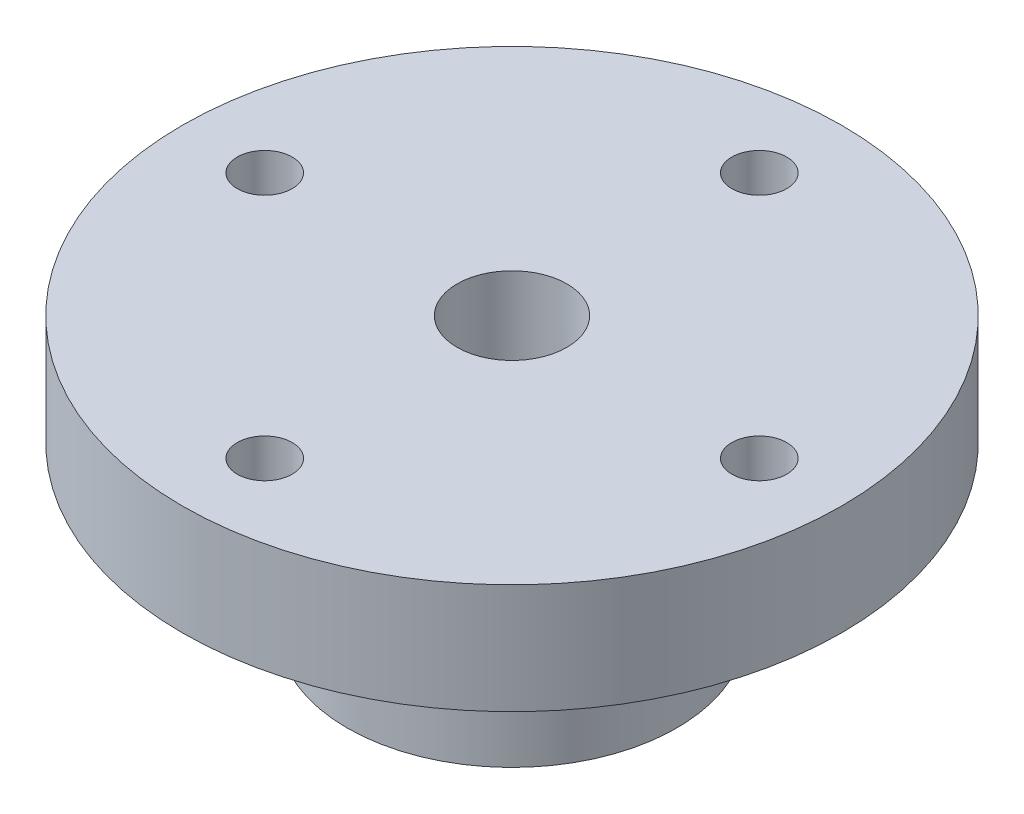
from build123d import *

# Parameters (mm, degrees)
SKETCH1_R               = 30
SKETCH1_R_2             = 5
BOSS_EXTRUDE4_DEPTH     = 10
SKETCH2_R               = 2.5
CUT_EXTRUDE1_DEPTH      = 10
BOSS_EXTRUDE5_START     = 15
SKETCH3_R               = 15
SKETCH3_R_2             = 5
BOSS_EXTRUDE5_DEPTH     = 15
CUT_EXTRUDE2_DEPTH      = 54
CUT_EXTRUDE2_DEPTH_BACK = 39
SKETCH4_R               = 2.5


with BuildPart() as part:
    # Sketch1 → Boss-Extrude4 (new body)
    with BuildSketch(Plane(origin=(0, 0, 0), x_dir=(1, 0, 0), z_dir=(0, 1, 0))):
        Circle(SKETCH1_R)
        Circle(SKETCH1_R_2, mode=Mode.SUBTRACT)
    extrude(amount=BOSS_EXTRUDE4_DEPTH)

    # Sketch2 → Cut-Extrude1 (cut)
    with BuildSketch(Plane(origin=(0, 10, 0), x_dir=(1, 0, 0), z_dir=(0, 1, 0))):
        with Locations((0, 22.5)):
            Circle(SKETCH2_R)
        with Locations((22.5, 0)):
            Circle(SKETCH2_R)
        with Locations((0, -22.5)):
            Circle(SKETCH2_R)
        with Locations((-22.5, 0)):
            Circle(SKETCH2_R)
    extrude(amount=-CUT_EXTRUDE1_DEPTH, mode=Mode.SUBTRACT)

    # Sketch3 → Boss-Extrude5 (add)
    with BuildSketch(Plane.XZ.offset(BOSS_EXTRUDE5_START)):
        Circle(SKETCH3_R)
        Circle(SKETCH3_R_2, mode=Mode.SUBTRACT)
    extrude(amount=-BOSS_EXTRUDE5_DEPTH)

    # Sketch4 → Cut-Extrude2 (cut, two sides: drawn at the far end of the back side and taken through both)
    with BuildSketch(Plane.XY.offset(-CUT_EXTRUDE2_DEPTH_BACK)):
        with Locations((0, -7.5)):
            Circle(SKETCH4_R)
    extrude(amount=CUT_EXTRUDE2_DEPTH + CUT_EXTRUDE2_DEPTH_BACK, mode=Mode.SUBTRACT)


solid = part.part
